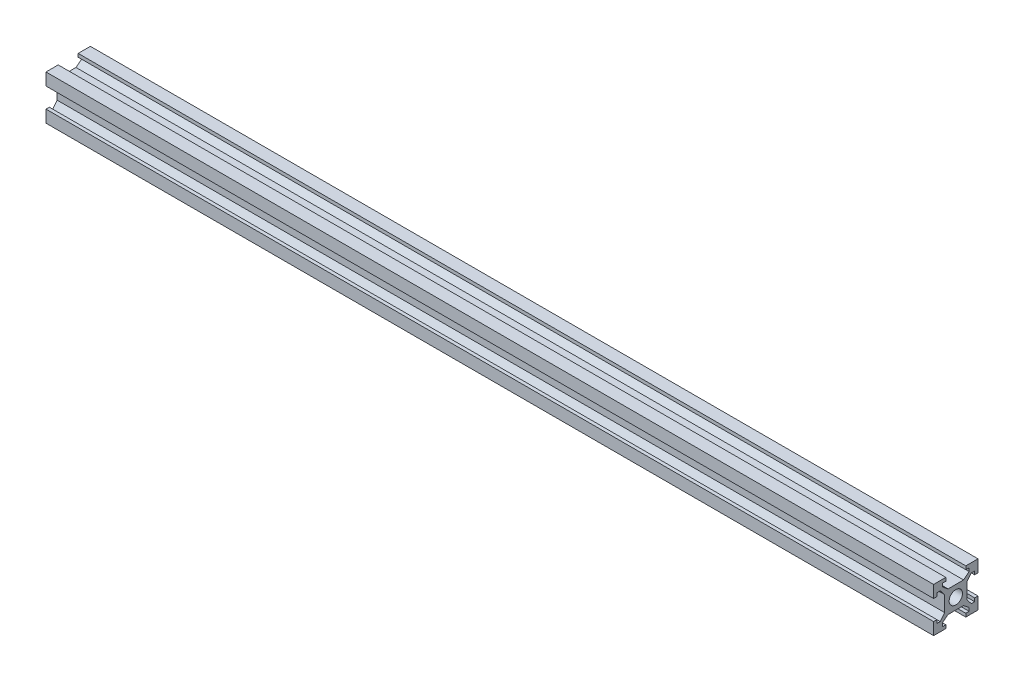
from build123d import *

# Parameters (mm, degrees)
SKETCH1_W           = 20
SKETCH1_H           = 20
BOSS_EXTRUDE1_DEPTH = 400
SKETCH2_R           = 3
CUT_EXTRUDE1_DEPTH  = 401.249921924
CUT_EXTRUDE2_DEPTH  = 401.249921924
CIRPATTERN1_COUNT   = 4


with BuildPart() as part:
    # Sketch1 → Boss-Extrude1 (new body)
    with BuildSketch(Plane(origin=(0, 0, 0), x_dir=(0, 0, -1), z_dir=(1, 0, 0))):
        Rectangle(SKETCH1_W, SKETCH1_H)
    extrude(amount=BOSS_EXTRUDE1_DEPTH)

    # Sketch2 → Cut-Extrude1 (cut, through all)
    with BuildSketch(Plane(origin=(400, 0, 0), x_dir=(0, 0, -1), z_dir=(1, 0, 0))):
        Circle(SKETCH2_R)
    extrude(amount=-CUT_EXTRUDE1_DEPTH, mode=Mode.SUBTRACT)

    # Sketch2<3> → Cut-Extrude2 (cut, through all)
    with BuildSketch(Plane(origin=(400, 0, 0), x_dir=(0, 0, -1), z_dir=(1, 0, 0))):
        Polygon((-3.5, 5), (3.5, 5), (6, 7), (6, 8.5), (4.5, 8.5), (4.5, 10), (-4.5, 10), (-4.5, 8.5), (-6, 8.5), (-6, 7), align=None)
    cut_extrude2 = extrude(amount=-CUT_EXTRUDE2_DEPTH, mode=Mode.SUBTRACT)

    # CirPattern1: Cut-Extrude2 ×4 about axis
    cirpattern1_axis = Axis((0, 0, 0), (1, 0, 0))
    for i in range(1, CIRPATTERN1_COUNT):
        add(cut_extrude2.rotate(cirpattern1_axis, i * 360 / CIRPATTERN1_COUNT), mode=Mode.SUBTRACT)


solid = part.part
